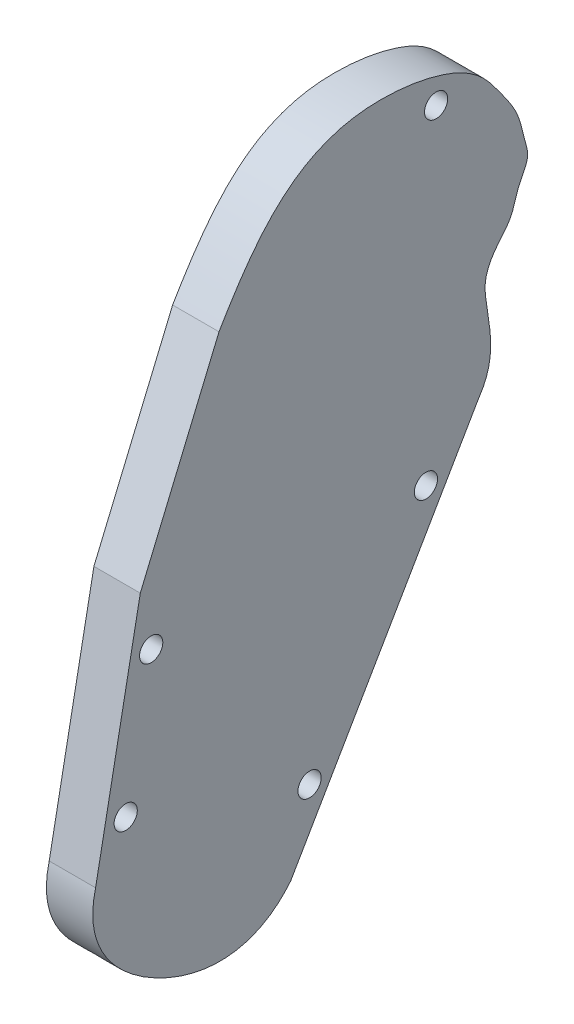
from build123d import *

# Parameters (mm, degrees)
BOSS_EXTRUDE1_DEPTH = 5
SKETCH2_R           = 1.25
CUT_EXTRUDE2_DEPTH  = 100


with BuildPart() as part:
    # Sketch1 → Boss-Extrude1 (new body)
    with BuildSketch(Plane(origin=(0, 0, 0), x_dir=(0, 0, -1), z_dir=(1, 0, 0))):
        with BuildLine():
            Line((-22.742960493, -21.856113648), (-17.922876831, 3.242686009))
            Line((-17.922876831, 3.242686009), (-9.438985974, 23.395908543))
            add(Edge.make_bspline(
                [(18.57649003, 3.242686009), (20.399875341, 5.871472338), (19.686678584, 9.392169109), (19.056732911, 13.819256879), (20.207128324, 16.284698509), (22.236157968, 18.154123407), (22.664736548, 20.900077477), (24.142385136, 22.874612328), (23.371166039, 25.110417667), (22.923217745, 27.756618982), (21.020450988, 30.360376627), (19.111474243, 33.014652762), (16.820610384, 34.5537712), (13.572626531, 35.783515921), (9.241399662, 36.514487685), (4.112699816, 36.229915261), (-3.478859823, 33.086265385), (-7.117399203, 27.318143956), (-9.438985974, 23.395908543)],
                knots=[0, 0, 0, 0, 0.124663564, 0.161437725, 0.195659694, 0.241956702, 0.28031453, 0.317452049, 0.342380683, 0.380427051, 0.438288461, 0.482854303, 0.52677939, 0.559206089, 0.638222424, 0.721837052, 0.785951738, 1, 1, 1, 1], degree=3))
            Line((18.57649003, 3.242686009), (-1.715623911, -31.739081671))
            add(Edge.make_bspline(
                [(-22.742960493, -21.856113648), (-24.142385136, -27.302834512), (-16.603948378, -35.664651683), (-5.598094876, -36.514487685), (-1.715623911, -31.739081671)],
                knots=[0, 0, 0, 0, 0.48418997, 1, 1, 1, 1], degree=3))
        make_face()
    extrude(amount=-BOSS_EXTRUDE1_DEPTH)

    # Sketch2 → Cut-Extrude2 (cut)
    with BuildSketch(Plane(origin=(53, 0, 0), x_dir=(0, 0, -1), z_dir=(1, 0, 0))):
        with Locations(Location((-16.750543677, -2.582958588, 0), (0, 0, 180))):
            Circle(SKETCH2_R)
        with Locations(Location((-19.496048989, -16.879160193, 0), (0, 0, 180))):
            Circle(SKETCH2_R)
        with Locations(Location((0.322780066, -23.740912204, 0), (0, 0, 180))):
            Circle(SKETCH2_R)
        with Locations(Location((12.866975999, -2.11585386, 0), (0, 0, 180))):
            Circle(SKETCH2_R)
        with Locations(Location((13.963221564, 32.829570985, 0), (0, 0, 180))):
            Circle(SKETCH2_R)
    extrude(amount=-CUT_EXTRUDE2_DEPTH, mode=Mode.SUBTRACT)


solid = part.part
